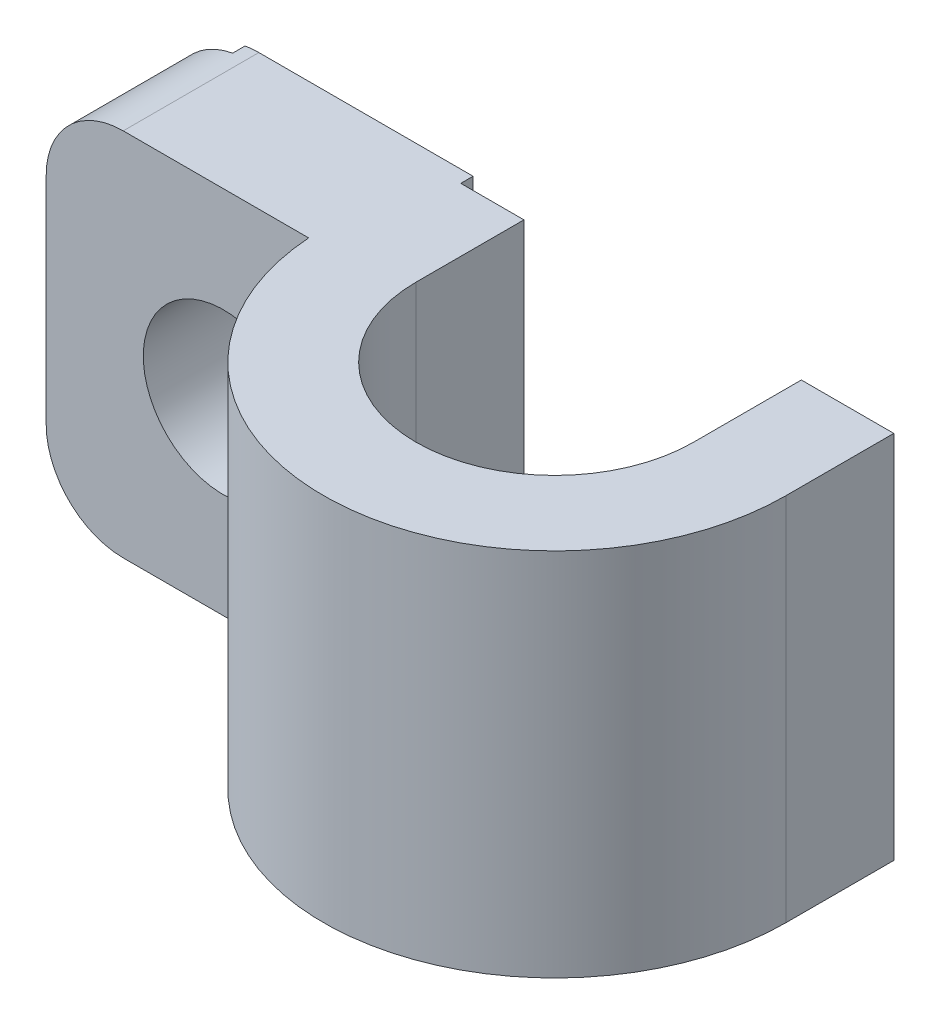
from build123d import *

# Parameters (mm, degrees)
SKETCH_1_W          = 12
SKETCH_1_H          = 12
EXTRUDE_1_DEPTH     = 4
EXTRUDE_2_DEPTH     = 12
CUT_EXTRUDE_3_DEPTH = 29.587584718
SKETCH_5_W          = 7.4
SKETCH_5_H          = 12
EXTRUDE_3_DEPTH     = 0.4
SKETCH_3_R          = 2.6
CUT_EXTRUDE_1_DEPTH = 28.299267389
SKETCH_4_R          = 5
CUT_EXTRUDE_2_DEPTH = 28.299267389
FILLET_1_R          = 2.5


with BuildPart() as part:
    # Эскиз1 → Бобышка-Вытянуть1 (new body)
    with BuildSketch(Plane.XY):
        with Locations((6, 6)):
            Rectangle(SKETCH_1_W, SKETCH_1_H)
    extrude(amount=EXTRUDE_1_DEPTH)

    # Эскиз2 → Бобышка-Вытянуть2 (add)
    with BuildSketch(Plane(origin=(0, 12, 0), x_dir=(1, 0, 0), z_dir=(0, 1, 0))):
        with BuildLine():
            Line((8.5, 0), (23.5, 0))
            Line((23.5, 0), (23.5, -3.5))
            ThreePointArc((23.5, -3.5), (16, -11), (8.5, -3.5))
            Line((8.5, -3.5), (8.5, 0))
        make_face()
    extrude(amount=-EXTRUDE_2_DEPTH)

    # Эскиз6 → Вырез-Вытянуть3 (cut, through all)
    with BuildSketch(Plane(origin=(0, 12, 0), x_dir=(1, 0, 0), z_dir=(0, 1, 0))):
        with BuildLine():
            Line((11.5, -3.5), (11.5, 0))
            Line((11.5, 0), (20.5, 0))
            Line((20.5, 0), (20.5, -3.5))
            ThreePointArc((20.5, -3.5), (16, -8), (11.5, -3.5))
        make_face()
    extrude(amount=-CUT_EXTRUDE_3_DEPTH, mode=Mode.SUBTRACT)

    # Эскиз5 → Бобышка-Вытянуть3 (add)
    with BuildSketch(Plane(origin=(0, 0, 0), x_dir=(-1, 0, 0), z_dir=(0, 0, -1))):
        with Locations((-5.75, 6)):
            Rectangle(SKETCH_5_W, SKETCH_5_H)
    extrude(amount=EXTRUDE_3_DEPTH)

    # Эскиз3 → Вырез-Вытянуть1 (cut, through all)
    with BuildSketch(Plane.XY.offset(4)):
        with Locations((5.75, 6)):
            Circle(SKETCH_3_R)
    extrude(amount=-CUT_EXTRUDE_1_DEPTH, mode=Mode.SUBTRACT)

    # Эскиз4 → Вырез-Вытянуть2 (cut, through all)
    with BuildSketch(Plane.XY.offset(4)):
        with Locations((5.75, 6)):
            Circle(SKETCH_4_R)
    extrude(amount=CUT_EXTRUDE_2_DEPTH, mode=Mode.SUBTRACT)

    # Скругление1
    fillet_1_edges = [part.edges().sort_by_distance(p)[0] for p in [
        (0, 12, 2),
        (0, 0, 2),
    ]]
    fillet(fillet_1_edges, radius=FILLET_1_R)


solid = part.part
